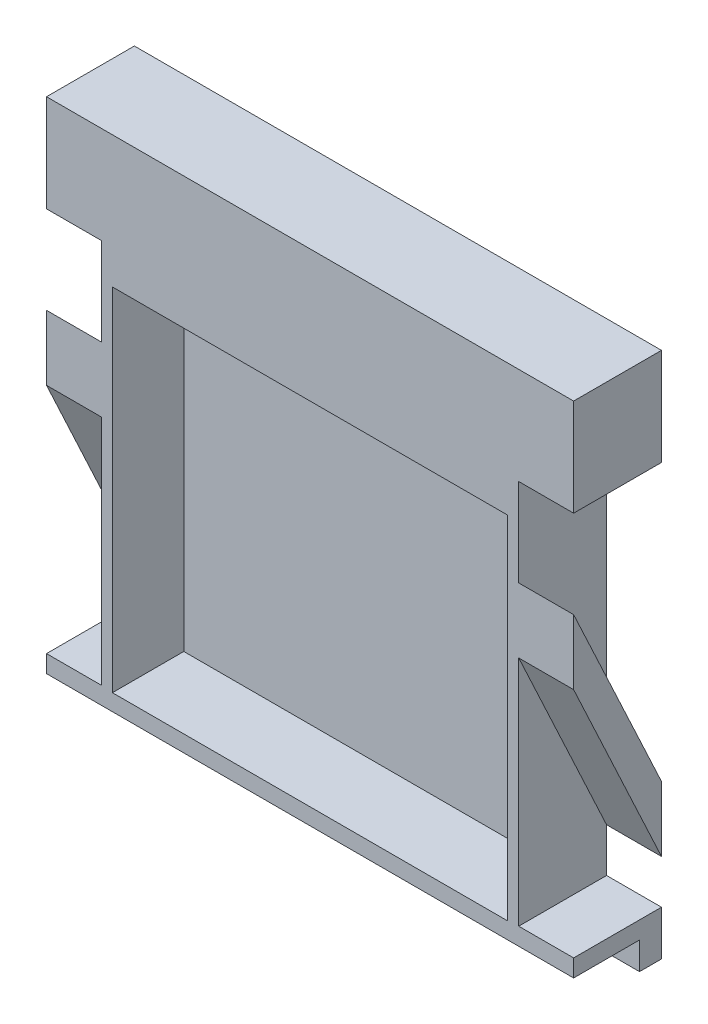
from build123d import *

# Parameters (mm, degrees)
SKETCH1_W                  = 304.8
SKETCH1_H                  = 304.8
BLANK_DEPTH                = 50.8
SKETCH2_W                  = 228.6
SKETCH2_H                  = 203.2
ROUGH_BATTERY_CAVITY_DEPTH = 41.275
SKETCH3_W                  = 304.8
SKETCH3_H                  = 15.875
BUMPER_RAIL_DEPTH          = 38.1
SKETCH4_R                  = 3.302
BUMPER_RAIL_HOLES_DEPTH    = 219.867836833
DRIVE_MOTOR_RAIL_DEPTH     = 31.75


with BuildPart() as part:
    # Sketch1 → Blank (new body)
    with BuildSketch(Plane.XY):
        Rectangle(SKETCH1_W, SKETCH1_H)
    extrude(amount=BLANK_DEPTH)

    # Sketch2 → Rough battery cavity (cut)
    with BuildSketch(Plane.XY.offset(50.8)):
        with Locations((0, -25.4)):
            Rectangle(SKETCH2_W, SKETCH2_H)
    extrude(amount=-ROUGH_BATTERY_CAVITY_DEPTH, mode=Mode.SUBTRACT)

    # Sketch3 → Bumper rail (cut)
    with BuildSketch(Plane.XY.offset(50.8)):
        with Locations((0, -144.4625)):
            Rectangle(SKETCH3_W, SKETCH3_H)
    extrude(amount=-BUMPER_RAIL_DEPTH, mode=Mode.SUBTRACT)

    # Sketch4 → Bumper rail holes (cut, through all)
    with BuildSketch(Plane.XY.offset(12.7)):
        with Locations((-127, -146.05)):
            Circle(SKETCH4_R)
        with Locations((127, -146.05)):
            Circle(SKETCH4_R)
        with Locations((-63.5, -146.05)):
            Circle(SKETCH4_R)
        with Locations((0, -146.05)):
            Circle(SKETCH4_R)
        with Locations((63.5, -146.05)):
            Circle(SKETCH4_R)
    extrude(amount=-BUMPER_RAIL_HOLES_DEPTH, mode=Mode.SUBTRACT)

    # Sketch5 → Drive motor rail (cut)
    with BuildSketch(Plane(origin=(152.4, 0, 0), x_dir=(0, 0, -1), z_dir=(1, 0, 0))):
        Polygon((-50.8, 45.440951562), (0, -63.5), (0, 96.240951562), (-50.8, 96.240951562), align=None)
        Polygon((-50.8, 7.877501429), (0, -101.063450133), (0, -126.463450133), (-50.8, -126.463450133), align=None)
    drive_motor_rail = extrude(amount=-DRIVE_MOTOR_RAIL_DEPTH, mode=Mode.SUBTRACT)

    # Drive motor rail mirror: Drive motor rail across plane
    add(drive_motor_rail.mirror(Plane(origin=(0, 0, 0), x_dir=(0, 0, 1), z_dir=(1, 0, 0))), mode=Mode.SUBTRACT)


solid = part.part
